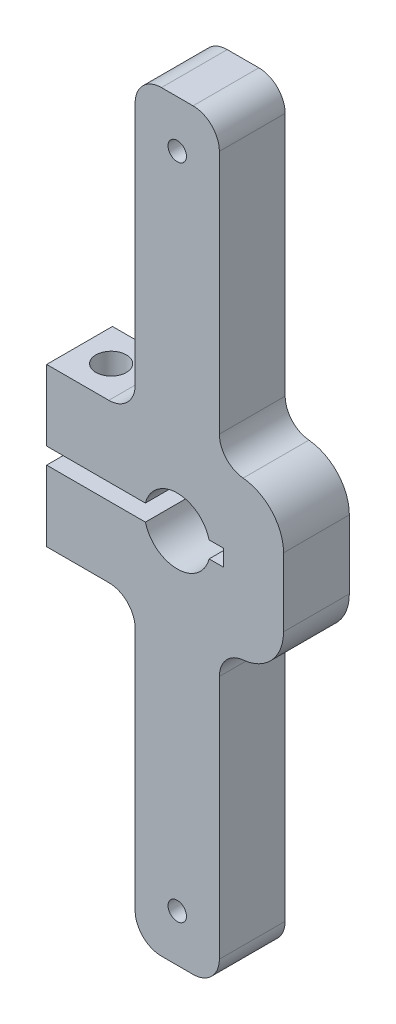
from build123d import *

# Parameters (mm, degrees)
EXTRUDE1_DEPTH              = 6.35
SKETCH2_W                   = 17.047492734
SKETCH2_H                   = 1.5875
EXTRUDE2_DEPTH              = 24.670955704
SKETCH4_R                   = 3.175
EXTRUDE4_DEPTH              = 24.670955704
FILLET2_R                   = 4.318
F_32_0_116_DIAMETER_HOLE1_D = 2.9464
EXTRUDE8_DEPTH              = 28.6766
FILLET1_R                   = 2.54


with BuildPart() as part:
    # Sketch1 → Extrude1 (new body)
    with BuildSketch(Plane.XY):
        Polygon((-21.492492734, 7.62), (-6.252492734, 7.62), (1.367507266, 7.62), (1.367507266, 0), (1.367507266, -7.62), (-6.252492734, -7.62), (-21.492492734, -7.62), align=None)
    extrude(amount=EXTRUDE1_DEPTH)

    # Sketch2 → Extrude2 (cut, through all)
    with BuildSketch(Plane.XY.offset(6.35)):
        with Locations((-12.968746367, 0)):
            Rectangle(SKETCH2_W, SKETCH2_H)
    extrude(amount=-EXTRUDE2_DEPTH, mode=Mode.SUBTRACT)

    # Sketch4 → Extrude4 (cut, through all)
    with BuildSketch(Plane.XY.offset(6.35)):
        with Locations((-8.89, 0)):
            Circle(SKETCH4_R)
    extrude(amount=-EXTRUDE4_DEPTH, mode=Mode.SUBTRACT)

    # Fillet2
    fillet2_edges = [part.edges().sort_by_distance(p)[0] for p in [
        (1.367507266, 7.62, 3.175),
        (1.367507266, -7.62, 3.175),
    ]]
    fillet(fillet2_edges, radius=FILLET2_R)

    # #32 (0.116) Diameter Hole1 (through all)
    with Locations(Plane(origin=(-18.444492734, -7.62, 3.175), x_dir=(0, 0, -1), z_dir=(0, -1, 0))):
        with Locations((0, 0)):
            Hole(F_32_0_116_DIAMETER_HOLE1_D / 2)

    # Sketch21 → Extrude8 (add)
    with BuildSketch(Plane(origin=(0, 7.62, 0), x_dir=(1, 0, 0), z_dir=(0, 1, 0))):
        Polygon((-8.89, 0), (-4.826, 0), (-4.826, -6.35), (-12.954, -6.35), (-12.954, 0), align=None)
    extrude8 = extrude(amount=EXTRUDE8_DEPTH)

    # Sketch27 → #50 (0.07) Diameter Hole1 (revolve, cut)
    with BuildSketch(Plane(origin=(-8.89, 31.75, 0), x_dir=(0, 1, 0), z_dir=(1, 0, 0))):
        Polygon((0, 0), (0, 6.88416509), (0.889, 6.35), (0.889, 0), align=None)
    f_50_0_07_diameter_hole1 = revolve(axis=Axis((-8.89, 31.75, -6.35), (0, 0, 1)), mode=Mode.SUBTRACT)

    # Mirror2: Extrude8, #50 (0.07) Diameter Hole1 across plane
    add(extrude8.mirror(Plane.ZX))
    add(f_50_0_07_diameter_hole1.mirror(Plane.ZX), mode=Mode.SUBTRACT)

    # Fillet1
    fillet1_edges = [part.edges().sort_by_distance(p)[0] for p in [
        (-12.954, 7.62, 3.175),
        (-4.826, 7.62, 3.175),
        (-12.954, 36.2966, 3.175),
        (-4.826, 36.2966, 3.175),
        (-12.954, -36.2966, 3.175),
        (-12.954, -7.62, 3.175),
        (-4.826, -7.62, 3.175),
        (-4.826, -36.2966, 3.175),
    ]]
    fillet(fillet1_edges, radius=FILLET1_R)


solid = part.part
